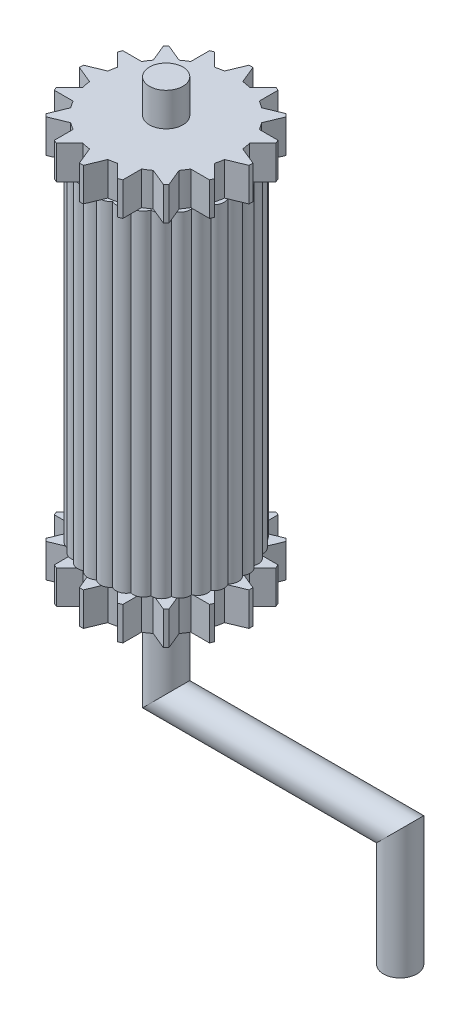
from build123d import *

# Parameters (mm, degrees)
BOSS_EXTRUDE2_DEPTH = 100
BOSS_EXTRUDE3_DEPTH = 10
SKETCH4_R           = 5
BOSS_EXTRUDE4_DEPTH = 10
SWEEP1_PROFILE_R    = 5


with BuildPart() as part:
    # Sketch2 → Boss-Extrude2 (new body)
    with BuildSketch(Plane(origin=(0, 0, 0), x_dir=(-1, 0, 0), z_dir=(0, 1, 0))):
        with BuildLine():
            ThreePointArc((20.69149522, 2.174763782), (21.625, 0), (20.69149522, -2.174763782))
            ThreePointArc((20.69149522, -2.174763782), (21.152441866, -4.496090314), (19.78717759, -6.429243732))
            ThreePointArc((19.78717759, -6.429243732), (19.755420522, -8.795679907), (18.01806535, -10.40273488))
            ThreePointArc((18.01806535, -10.40273488), (17.494992503, -12.710856081), (15.461477194, -13.921576596))
            ThreePointArc((15.461477194, -13.921576596), (14.469949363, -16.070506851), (12.229148292, -16.831978612))
            ThreePointArc((12.229148292, -16.831978612), (10.8125, -18.727799357), (8.462346928, -19.006742394))
            ThreePointArc((8.462346928, -19.006742394), (6.682492503, -20.566597165), (4.325700396, -20.350820328))
            ThreePointArc((4.325700396, -20.350820328), (2.260428018, -21.506535987), (0, -20.80546976))
            ThreePointArc((0, -20.80546976), (-2.260428018, -21.506535987), (-4.325700396, -20.350820328))
            ThreePointArc((-4.325700396, -20.350820328), (-6.682492503, -20.566597165), (-8.462346928, -19.006742394))
            ThreePointArc((-8.462346928, -19.006742394), (-10.8125, -18.727799357), (-12.229148292, -16.831978612))
            ThreePointArc((-12.229148292, -16.831978612), (-14.469949363, -16.070506851), (-15.461477194, -13.921576596))
            ThreePointArc((-15.461477194, -13.921576596), (-17.494992503, -12.710856081), (-18.01806535, -10.40273488))
            ThreePointArc((-18.01806535, -10.40273488), (-19.755420522, -8.795679907), (-19.78717759, -6.429243732))
            ThreePointArc((-19.78717759, -6.429243732), (-21.152441866, -4.496090314), (-20.69149522, -2.174763782))
            ThreePointArc((-20.69149522, -2.174763782), (-21.625, 0), (-20.69149522, 2.174763782))
            ThreePointArc((-20.69149522, 2.174763782), (-21.152441866, 4.496090314), (-19.78717759, 6.429243732))
            ThreePointArc((-19.78717759, 6.429243732), (-19.755420522, 8.795679907), (-18.01806535, 10.40273488))
            ThreePointArc((-18.01806535, 10.40273488), (-17.494992503, 12.710856081), (-15.461477194, 13.921576596))
            ThreePointArc((-15.461477194, 13.921576596), (-14.469949363, 16.070506851), (-12.229148292, 16.831978612))
            ThreePointArc((-12.229148292, 16.831978612), (-10.8125, 18.727799357), (-8.462346928, 19.006742394))
            ThreePointArc((-8.462346928, 19.006742394), (-6.682492503, 20.566597165), (-4.325700396, 20.350820328))
            ThreePointArc((-4.325700396, 20.350820328), (-2.260428018, 21.506535987), (0, 20.80546976))
            ThreePointArc((0, 20.80546976), (2.260428018, 21.506535987), (4.325700396, 20.350820328))
            ThreePointArc((4.325700396, 20.350820328), (6.682492503, 20.566597165), (8.462346928, 19.006742394))
            ThreePointArc((8.462346928, 19.006742394), (10.8125, 18.727799357), (12.229148292, 16.831978612))
            ThreePointArc((12.229148292, 16.831978612), (14.469949363, 16.070506851), (15.461477194, 13.921576596))
            ThreePointArc((15.461477194, 13.921576596), (17.494992503, 12.710856081), (18.01806535, 10.40273488))
            ThreePointArc((18.01806535, 10.40273488), (19.755420522, 8.795679907), (19.78717759, 6.429243732))
            ThreePointArc((19.78717759, 6.429243732), (21.152441866, 4.496090314), (20.69149522, 2.174763782))
        make_face()
    extrude(amount=BOSS_EXTRUDE2_DEPTH)

    # Sketch3 → Boss-Extrude3 (add)
    with BuildSketch(Plane.XZ):
        with BuildLine():
            Line((-2.733, 20.190872591), (-0.588491123, 25.368175007))
            ThreePointArc((-0.588491123, 25.368175007), (0, 25.375), (0.588491123, 25.368175007))
            Line((0.588491123, 25.368175007), (2.733, 20.190872591))
            ThreePointArc((2.733, 20.190872591), (3.974965311, 19.983500088), (5.201749663, 19.699807751))
            Line((5.201749663, 19.699807751), (9.164285381, 23.662343469))
            ThreePointArc((9.164285381, 23.662343469), (9.710592096, 23.443443137), (10.251675188, 23.211931864))
            Line((10.251675188, 23.211931864), (10.251675188, 17.60806011))
            ThreePointArc((10.251675188, 17.60806011), (11.319743498, 16.941193351), (12.344580094, 16.20962576))
            Line((12.344580094, 16.20962576), (17.52188251, 18.354134638))
            ThreePointArc((17.52188251, 18.354134638), (17.942834573, 17.942834573), (18.354134638, 17.52188251))
            Line((18.354134638, 17.52188251), (16.20962576, 12.344580094))
            ThreePointArc((16.20962576, 12.344580094), (16.941193351, 11.319743498), (17.60806011, 10.251675188))
            Line((17.60806011, 10.251675188), (23.211931864, 10.251675188))
            ThreePointArc((23.211931864, 10.251675188), (23.443443137, 9.710592096), (23.662343469, 9.164285381))
            Line((23.662343469, 9.164285381), (19.699807751, 5.201749663))
            ThreePointArc((19.699807751, 5.201749663), (19.983500088, 3.974965311), (20.190872591, 2.733))
            Line((20.190872591, 2.733), (25.368175007, 0.588491123))
            ThreePointArc((25.368175007, 0.588491123), (25.375, 0), (25.368175007, -0.588491123))
            Line((25.368175007, -0.588491123), (20.190872591, -2.733))
            ThreePointArc((20.190872591, -2.733), (19.983500088, -3.974965311), (19.699807751, -5.201749663))
            Line((19.699807751, -5.201749663), (23.662343469, -9.164285381))
            ThreePointArc((23.662343469, -9.164285381), (23.443443137, -9.710592096), (23.211931864, -10.251675188))
            Line((23.211931864, -10.251675188), (17.60806011, -10.251675188))
            ThreePointArc((17.60806011, -10.251675188), (16.941193351, -11.319743498), (16.20962576, -12.344580094))
            Line((16.20962576, -12.344580094), (18.354134638, -17.52188251))
            ThreePointArc((18.354134638, -17.52188251), (17.942834573, -17.942834573), (17.52188251, -18.354134638))
            Line((17.52188251, -18.354134638), (12.344580094, -16.20962576))
            ThreePointArc((12.344580094, -16.20962576), (11.319743498, -16.941193351), (10.251675188, -17.60806011))
            Line((10.251675188, -17.60806011), (10.251675188, -23.211931864))
            ThreePointArc((10.251675188, -23.211931864), (9.710592096, -23.443443137), (9.164285381, -23.662343469))
            Line((9.164285381, -23.662343469), (5.201749663, -19.699807751))
            ThreePointArc((5.201749663, -19.699807751), (3.974965311, -19.983500088), (2.733, -20.190872591))
            Line((2.733, -20.190872591), (0.588491123, -25.368175007))
            ThreePointArc((0.588491123, -25.368175007), (0, -25.375), (-0.588491123, -25.368175007))
            Line((-0.588491123, -25.368175007), (-2.733, -20.190872591))
            ThreePointArc((-2.733, -20.190872591), (-3.974965311, -19.983500088), (-5.201749663, -19.699807751))
            Line((-5.201749663, -19.699807751), (-9.164285381, -23.662343469))
            ThreePointArc((-9.164285381, -23.662343469), (-9.710592096, -23.443443137), (-10.251675188, -23.211931864))
            Line((-10.251675188, -23.211931864), (-10.251675188, -17.60806011))
            ThreePointArc((-10.251675188, -17.60806011), (-11.319743498, -16.941193351), (-12.344580094, -16.20962576))
            Line((-12.344580094, -16.20962576), (-17.52188251, -18.354134638))
            ThreePointArc((-17.52188251, -18.354134638), (-17.942834573, -17.942834573), (-18.354134638, -17.52188251))
            Line((-18.354134638, -17.52188251), (-16.20962576, -12.344580094))
            ThreePointArc((-16.20962576, -12.344580094), (-16.941193351, -11.319743498), (-17.60806011, -10.251675188))
            Line((-17.60806011, -10.251675188), (-23.211931864, -10.251675188))
            ThreePointArc((-23.211931864, -10.251675188), (-23.443443137, -9.710592096), (-23.662343469, -9.164285381))
            Line((-23.662343469, -9.164285381), (-19.699807751, -5.201749663))
            ThreePointArc((-19.699807751, -5.201749663), (-19.983500088, -3.974965311), (-20.190872591, -2.733))
            Line((-20.190872591, -2.733), (-25.368175007, -0.588491123))
            ThreePointArc((-25.368175007, -0.588491123), (-25.375, 0), (-25.368175007, 0.588491123))
            Line((-25.368175007, 0.588491123), (-20.190872591, 2.733))
            ThreePointArc((-20.190872591, 2.733), (-19.983500088, 3.974965311), (-19.699807751, 5.201749663))
            Line((-19.699807751, 5.201749663), (-23.662343469, 9.164285381))
            ThreePointArc((-23.662343469, 9.164285381), (-23.443443137, 9.710592096), (-23.211931864, 10.251675188))
            Line((-23.211931864, 10.251675188), (-17.60806011, 10.251675188))
            ThreePointArc((-17.60806011, 10.251675188), (-16.941193351, 11.319743498), (-16.20962576, 12.344580094))
            Line((-16.20962576, 12.344580094), (-18.354134638, 17.52188251))
            ThreePointArc((-18.354134638, 17.52188251), (-17.942834573, 17.942834573), (-17.52188251, 18.354134638))
            Line((-17.52188251, 18.354134638), (-12.344580094, 16.20962576))
            ThreePointArc((-12.344580094, 16.20962576), (-11.319743498, 16.941193351), (-10.251675188, 17.60806011))
            Line((-10.251675188, 17.60806011), (-10.251675188, 23.211931864))
            ThreePointArc((-10.251675188, 23.211931864), (-9.710592096, 23.443443137), (-9.164285381, 23.662343469))
            Line((-9.164285381, 23.662343469), (-5.201749663, 19.699807751))
            ThreePointArc((-5.201749663, 19.699807751), (-3.974965311, 19.983500088), (-2.733, 20.190872591))
        make_face()
    boss_extrude3 = extrude(amount=BOSS_EXTRUDE3_DEPTH)

    # Mirror1: Boss-Extrude3 across plane
    add(boss_extrude3.mirror(Plane.ZX.offset(50)))

    # Sketch4 → Boss-Extrude4 (add)
    with BuildSketch(Plane.XZ.offset(10)):
        with Locations(Location((0, 0, 0), (0, 0, 270))):
            Circle(SKETCH4_R)
    boss_extrude4 = extrude(amount=BOSS_EXTRUDE4_DEPTH)

    # Mirror2: Boss-Extrude4 across plane
    add(boss_extrude4.mirror(Plane.ZX.offset(50)))

    # Sweep1: sweep along a path in Sketch6
    with BuildLine(Plane(origin=(0, 0, 0), x_dir=(0, 1, 0), z_dir=(0, 0, 1))) as sweep1_path:
        Line((-20, 0), (-40, 0))
        Line((-40, 0), (-40, -70))
        Line((-40, -70), (-75, -70))
    # Sweep1 profile (on start of the path) → Sweep1 (sweep)
    with BuildSketch(Plane(origin=(0, -20, 0), x_dir=(-1, 0, 0), z_dir=(0, -1, 0))):
        Circle(SWEEP1_PROFILE_R)
    sweep(path=sweep1_path.line, transition=Transition.RIGHT)


solid = part.part
